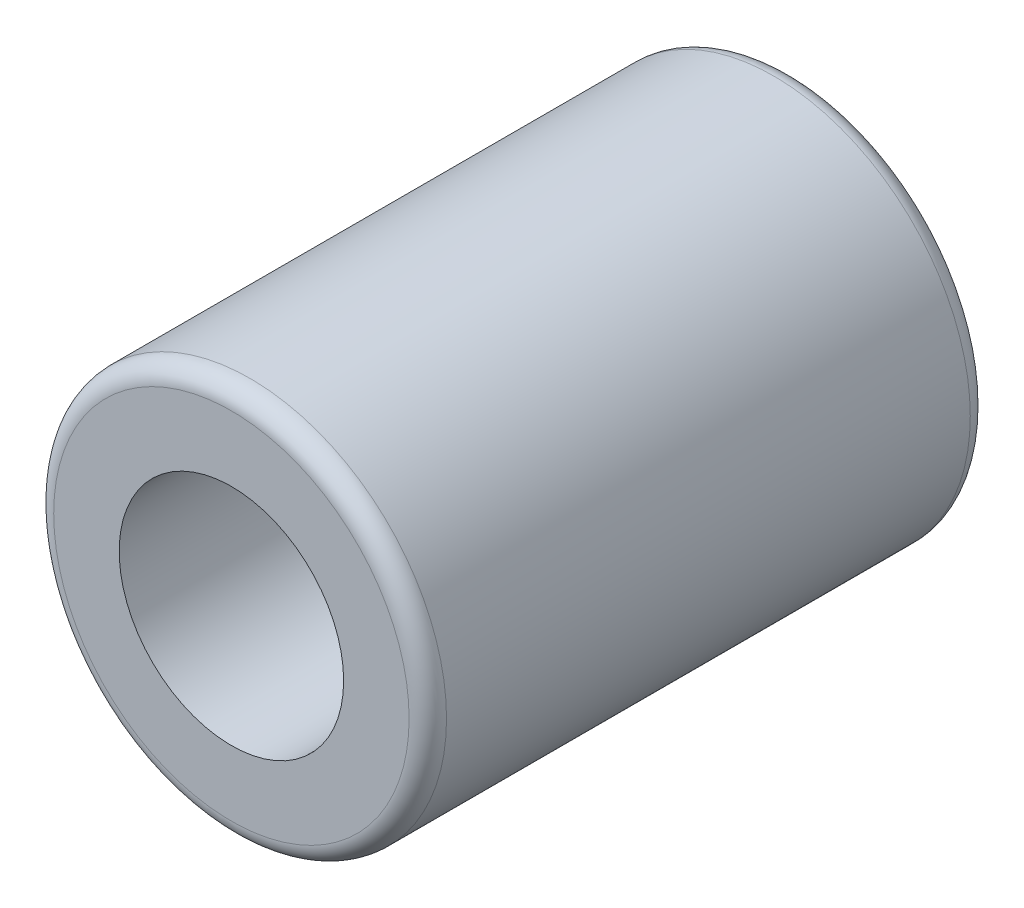
from build123d import *

# Parameters (mm, degrees)
ESBO_O1_R                = 10.5
ESBO_O1_R_2              = 6
RESSALTO_EXTRUS_O1_DEPTH = 30
FILETE1_R                = 1


with BuildPart() as part:
    # Esboço1 → Ressalto-extrusão1 (new body)
    with BuildSketch(Plane.XY):
        Circle(ESBO_O1_R)
        Circle(ESBO_O1_R_2, mode=Mode.SUBTRACT)
    extrude(amount=RESSALTO_EXTRUS_O1_DEPTH)

    # Filete1
    filete1_edges = [part.edges().sort_by_distance(p)[0] for p in [
        (-10.5, 0, 0),
        (-10.5, 0, 30),
    ]]
    fillet(filete1_edges, radius=FILETE1_R)


solid = part.part
